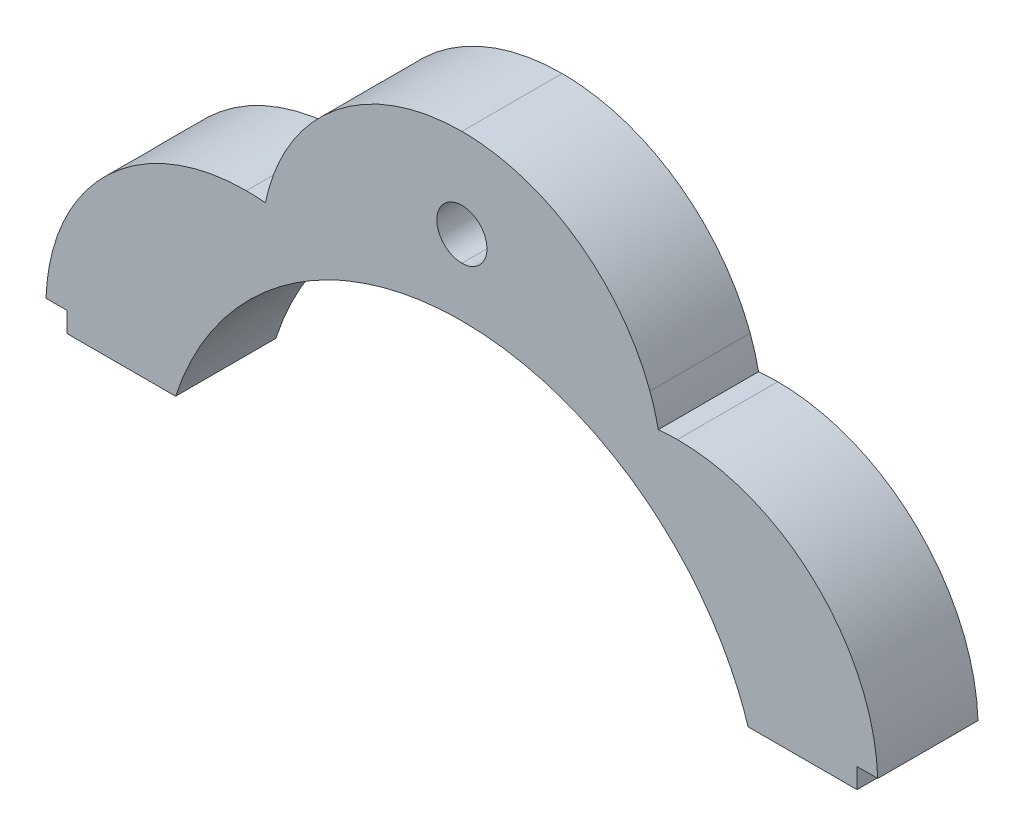
from build123d import *

# Parameters (mm, degrees)
EXTRUDE_1_DEPTH = 10


with BuildPart() as part:
    # 草图1 → 凸台-拉伸1 (new body)
    with BuildSketch(Plane.XY):
        with BuildLine():
            Line((-93.655985259, -14.891134333), (-91.585181426, -14.891134333))
            Line((-91.585181426, -14.891134333), (-91.585181426, -16.891378304))
            Line((-91.585181426, -16.891378304), (-80.726692626, -16.891378304))
            add(Edge.make_bspline(
                [(-80.726692626, -16.891378304), (-79.029832376, -11.620877444), (-75.911267347, -6.985393809), (-71.822584962, -3.436450227)],
                knots=[10, 10, 10, 10, 11, 11, 11, 11], degree=3))
            add(Edge.make_bspline(
                [(-71.822584962, -3.436450227), (-69.381347237, -1.319783561), (-66.597946936, 0.412367385), (-63.560513905, 1.657661744)],
                knots=[11, 11, 11, 11, 12, 12, 12, 12], degree=3))
            add(Edge.make_bspline(
                [(-63.560513905, 1.657661744), (-60.04686102, 3.100532329), (-56.20157463, 3.897813552), (-52.169327215, 3.897813552)],
                knots=[12, 12, 12, 12, 13, 13, 13, 13], degree=3))
            add(Edge.make_bspline(
                [(-52.169327215, 3.897813552), (-48.1370798, 3.897813552), (-44.28828372, 3.100532329), (-40.774609302, 1.654152053)],
                knots=[13, 13, 13, 13, 14, 14, 14, 14], degree=3))
            add(Edge.make_bspline(
                [(-40.774609302, 1.654152053), (-37.740707495, 0.408836163), (-34.95377597, -1.319783561), (-32.516069469, -3.436450227)],
                knots=[14, 14, 14, 14, 15, 15, 15, 15], degree=3))
            add(Edge.make_bspline(
                [(-32.516069469, -3.436450227), (-28.427387083, -6.985393809), (-25.308822054, -11.620877444), (-23.611961805, -16.891378304)],
                knots=[15, 15, 15, 15, 16, 16, 16, 16], degree=3))
            Line((-23.611961805, -16.891378304), (-12.753473004, -16.891378304))
            Line((-12.753473004, -16.891378304), (-12.753473004, -14.891134333))
            Line((-12.753473004, -14.891134333), (-10.682669172, -14.891134333))
            add(Edge.make_bspline(
                [(-10.682669172, -14.891134333), (-11.056612755, -4.173743725), (-19.861932306, 4.395220744), (-30.667517359, 4.395220744)],
                knots=[19, 19, 19, 19, 20, 20, 20, 20], degree=3))
            add(Edge.make_bspline(
                [(-30.667517359, 4.395220744), (-31.309575498, 4.395220744), (-31.948102414, 4.363482802), (-32.576057194, 4.303495077)],
                knots=[0, 0, 0, 0, 1, 1, 1, 1], degree=3))
            add(Edge.make_bspline(
                [(-32.576057194, 4.303495077), (-32.780652802, 5.301862217), (-33.06289225, 6.275532328), (-33.408607582, 7.217442966)],
                knots=[1, 1, 1, 1, 2, 2, 2, 2], degree=3))
            add(Edge.make_bspline(
                [(-33.408607582, 7.217442966), (-36.230829803, 14.837455883), (-43.56507205, 20.27022074), (-52.169327215, 20.27022074)],
                knots=[2, 2, 2, 2, 3, 3, 3, 3], degree=3))
            add(Edge.make_bspline(
                [(-52.169327215, 20.27022074), (-60.773582381, 20.27022074), (-68.107824627, 14.837455883), (-70.930046849, 7.217442966)],
                knots=[3, 3, 3, 3, 4, 4, 4, 4], degree=3))
            add(Edge.make_bspline(
                [(-70.930046849, 7.217442966), (-71.275783713, 6.275532328), (-71.558001629, 5.301862217), (-71.762597237, 4.303495077)],
                knots=[4, 4, 4, 4, 5, 5, 5, 5], degree=3))
            add(Edge.make_bspline(
                [(-71.762597237, 4.303495077), (-72.390552016, 4.363482802), (-73.02554771, 4.395220744), (-73.667605849, 4.395220744)],
                knots=[5, 5, 5, 5, 6, 6, 6, 6], degree=3))
            add(Edge.make_bspline(
                [(-73.667605849, 4.395220744), (-84.476722125, 4.395220744), (-93.282041676, -4.173743725), (-93.655985259, -14.891134333)],
                knots=[6, 6, 6, 6, 7, 7, 7, 7], degree=3))
        make_face()
        with BuildLine():
            add(Edge.make_bspline(
                [(-52.169327215, 8.882565273), (-53.548700384, 8.882565273), (-54.670531133, 10.004396022), (-54.670531133, 11.383747659), (-54.670531133, 12.763120827), (-53.548700384, 13.884951577), (-52.169327215, 13.884951577)],
                knots=[2, 2, 2, 2, 3, 3, 3, 4, 4, 4, 4], degree=3))
            add(Edge.make_bspline(
                [(-52.169327215, 13.884951577), (-50.789975579, 13.884951577), (-49.668144829, 12.763120827), (-49.668144829, 11.383747659), (-49.668144829, 10.004396022), (-50.789975579, 8.882565273), (-52.169327215, 8.882565273)],
                knots=[0, 0, 0, 0, 1, 1, 1, 2, 2, 2, 2], degree=3))
        make_face(mode=Mode.SUBTRACT)
    extrude(amount=EXTRUDE_1_DEPTH)


solid = part.part
